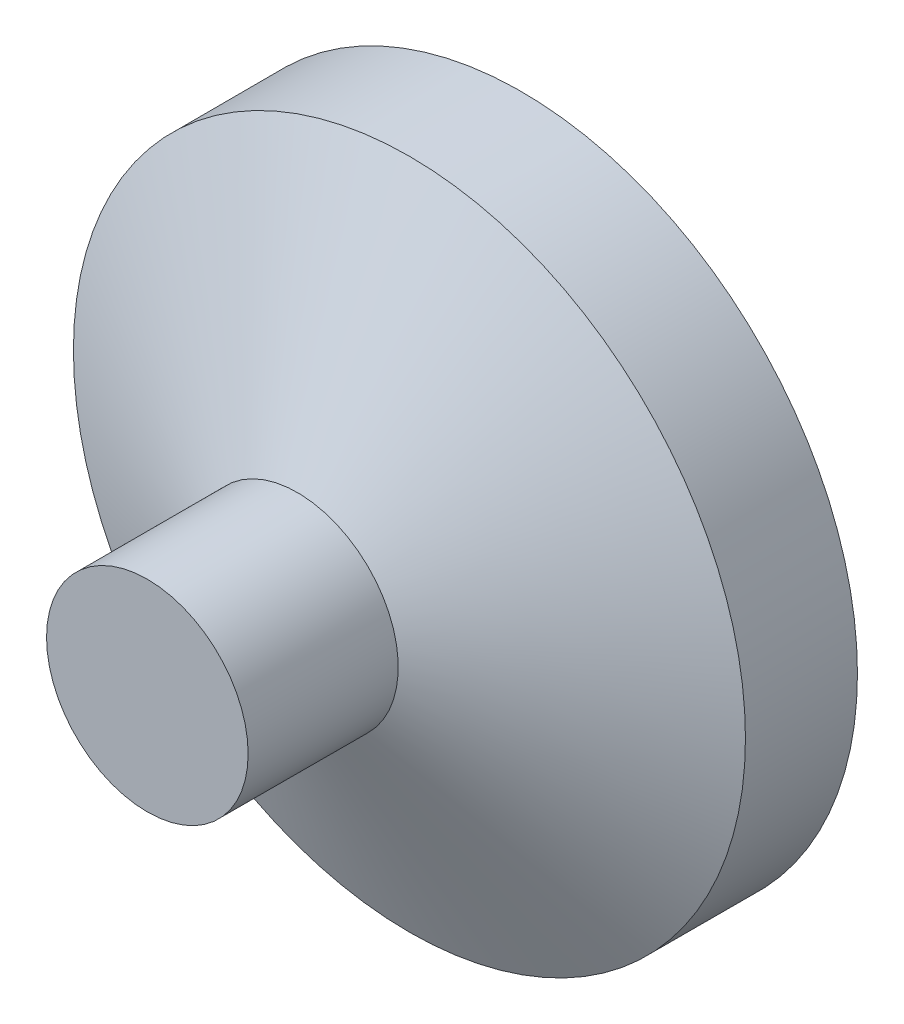
from build123d import *

# Parameters (mm, degrees)
SKETCH2_R           = 15
BOSS_EXTRUDE2_DEPTH = 5
SKETCH3_R           = 4.5
SKETCH3_2_R         = 4.5
BOSS_EXTRUDE3_DEPTH = 6.7
SKETCH1_R           = 1
CUT_EXTRUDE1_DEPTH  = 25.225812804


with BuildPart() as part:
    # Sketch2 → Boss-Extrude2 (new body)
    with BuildSketch(Plane.XY):
        Circle(SKETCH2_R)
    extrude(amount=-BOSS_EXTRUDE2_DEPTH)

    # Sketch3 → section 0 of loft1
    with BuildSketch(Plane.XY.offset(5), mode=Mode.PRIVATE) as loft1_s0:
        Circle(SKETCH3_R)
    # loft up to a face of the part (loft1)
    loft([loft1_s0.sketch, Face(Wire([part.edges().sort_by_distance((-10.268206589, 10.934529411, 0))[0]]))])

    # Sketch3<2> → Boss-Extrude3 (add)
    with BuildSketch(Plane.XY.offset(5)):
        Circle(SKETCH3_2_R)
    extrude(amount=BOSS_EXTRUDE3_DEPTH)

    # Sketch1 → Cut-Extrude1 (cut, through all)
    with BuildSketch(Plane.XY):
        with Locations((0, 10)):
            Circle(SKETCH1_R)
        with Locations((-8.660254038, -5)):
            Circle(SKETCH1_R)
        with Locations((8.660254038, -5)):
            Circle(SKETCH1_R)
    extrude(amount=-CUT_EXTRUDE1_DEPTH, mode=Mode.SUBTRACT)


solid = part.part
